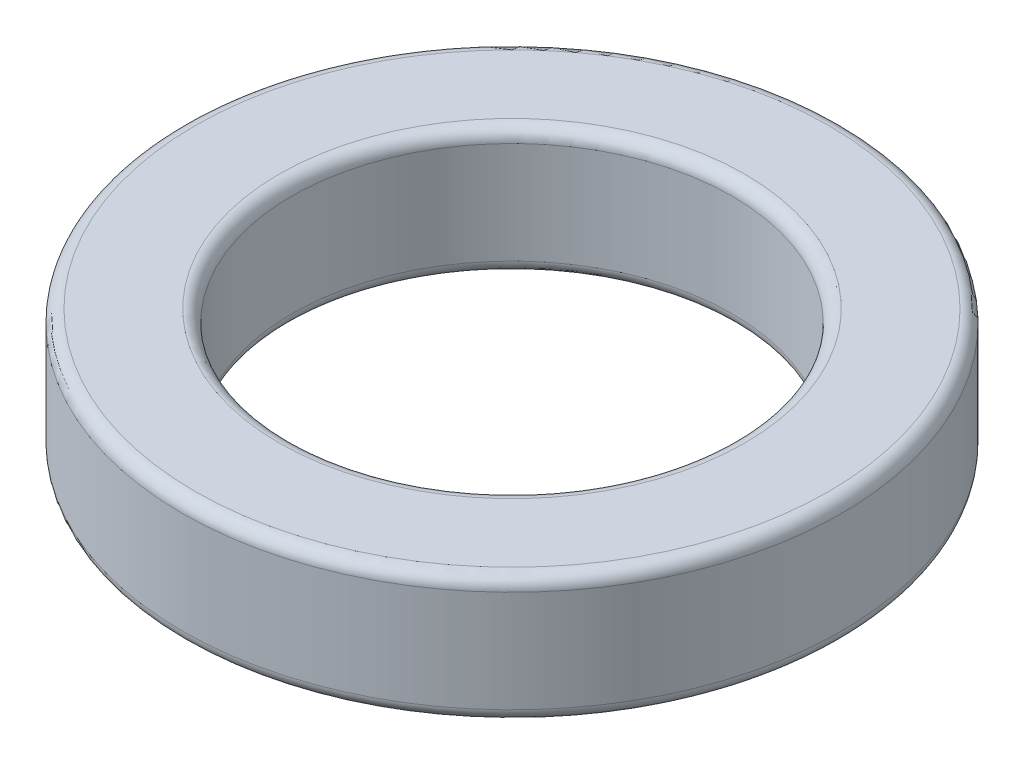
from build123d import *

# Parameters (mm, degrees)
SKETCH_1_R      = 12.95
SKETCH_1_R_2    = 8.65
EXTRUDE_1_DEPTH = 5
FILLET_1_R      = 0.5


with BuildPart() as part:
    # Эскиз1 → Бобышка-Вытянуть1 (new body)
    with BuildSketch(Plane(origin=(0, 0, 0), x_dir=(1, 0, 0), z_dir=(0, 1, 0))):
        with Locations(Location((0, 0, 0), (0, 0, 270))):
            Circle(SKETCH_1_R)
        with Locations(Location((0, 0, 0), (0, 0, 270))):
            Circle(SKETCH_1_R_2, mode=Mode.SUBTRACT)
    extrude(amount=EXTRUDE_1_DEPTH)

    # Скругление1
    fillet_1_edges = [part.edges().sort_by_distance(p)[0] for p in [
        (0, 0, -12.95),
        (0, 5, -12.95),
        (0, 0, -8.65),
        (0, 5, -8.65),
    ]]
    fillet(fillet_1_edges, radius=FILLET_1_R)


solid = part.part
